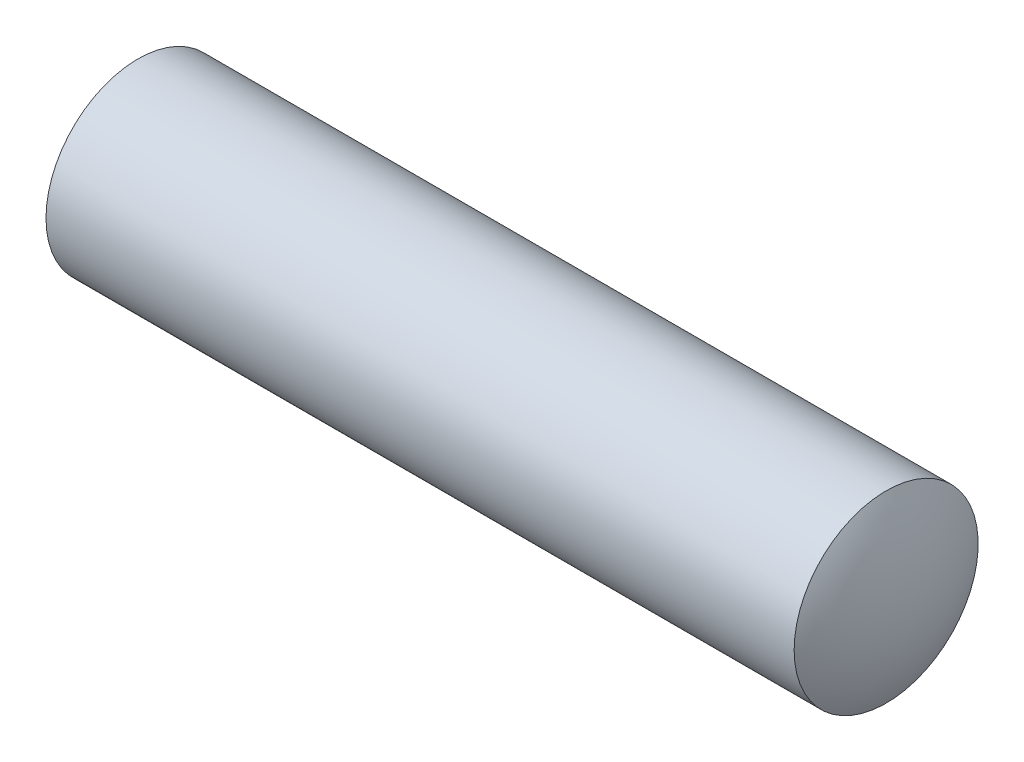
from build123d import *


with BuildPart() as part:
    # Esquisse1 → Base-Révolution (revolve)
    with BuildSketch(Plane.XY, mode=Mode.PRIVATE) as base_r_volution_sk:
        with BuildLine():
            Line((0.803847577, 3), (25.196152423, 3))
            ThreePointArc((25.196152423, 3), (25.795554958, 1.552914271), (26, 0))
            Line((26, 0), (0, 0))
            ThreePointArc((0, 0), (0.204445042, 1.552914271), (0.803847577, 3))
        make_face()
    revolve(base_r_volution_sk.sketch.rotate(Axis((0, 0, 0), (1, 0, 0)), 90), axis=Axis((0, 0, 0), (1, 0, 0)))


solid = part.part
